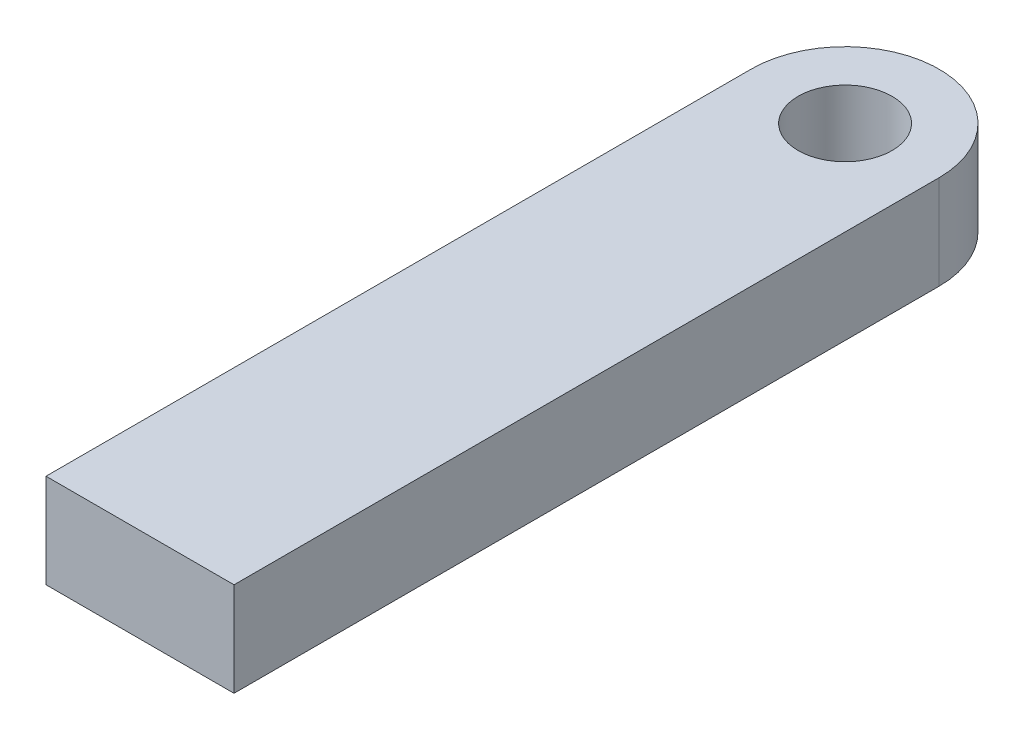
from build123d import *

# Parameters (mm, degrees)
SKETCH_1_W               = 40
SKETCH_1_H               = 20
EXTRUDE_2_DEPTH          = 150
SKETCH_5_R               = 20
EXTRUDE_3_DEPTH          = 20
CUT_EXTRUDE_1_DEPTH      = 153.643375225
CUT_EXTRUDE_1_DEPTH_BACK = 153.643375225
SKETCH_6_R               = 10


with BuildPart() as part:
    # 스케치1 → 보스-돌출2 (new body)
    with BuildSketch(Plane.XY):
        Rectangle(SKETCH_1_W, SKETCH_1_H)
    extrude(amount=EXTRUDE_2_DEPTH)

    # 스케치5 → 보스-돌출3 (add)
    with BuildSketch(Plane(origin=(0, 10, 0), x_dir=(1, 0, 0), z_dir=(0, 1, 0))):
        Circle(SKETCH_5_R)
    extrude(amount=-EXTRUDE_3_DEPTH)

    # 스케치6 → 컷-돌출1 (cut, two sides: drawn at the far end of the back side and taken through both)
    with BuildSketch(Plane(origin=(0, 10, 0), x_dir=(1, 0, 0), z_dir=(0, 1, 0)).offset(-CUT_EXTRUDE_1_DEPTH_BACK)):
        with Locations(Location((0, 0, 0), (0, 0, 180))):
            Circle(SKETCH_6_R)
    extrude(amount=CUT_EXTRUDE_1_DEPTH + CUT_EXTRUDE_1_DEPTH_BACK, mode=Mode.SUBTRACT)


solid = part.part
